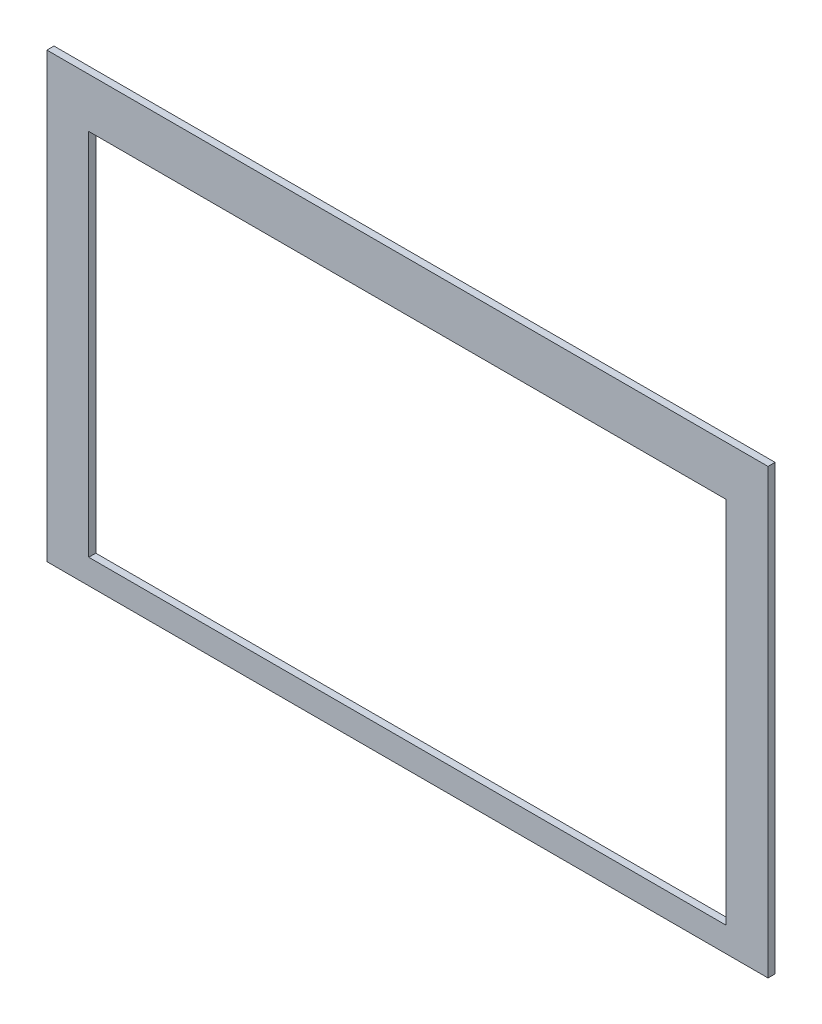
from build123d import *

# Parameters (mm, degrees)
SKETCH_1_W          = 612
SKETCH_1_H          = 376
EXTRUDE_1_DEPTH     = 6
SKETCH_2_W          = 541
SKETCH_2_H          = 313
CUT_EXTRUDE_1_DEPTH = 6


with BuildPart() as part:
    # Эскиз1 → Бобышка-Вытянуть1 (new body)
    with BuildSketch(Plane.XY):
        with Locations((1056.911763318, 326.60673348)):
            Rectangle(SKETCH_1_W, SKETCH_1_H)
    extrude(amount=EXTRUDE_1_DEPTH)

    # Эскиз2 → Вырез-Вытянуть1 (cut)
    with BuildSketch(Plane.XY.offset(6)):
        with Locations((1056.911763318, 316.10673348)):
            Rectangle(SKETCH_2_W, SKETCH_2_H)
    extrude(amount=-CUT_EXTRUDE_1_DEPTH, mode=Mode.SUBTRACT)


solid = part.part
